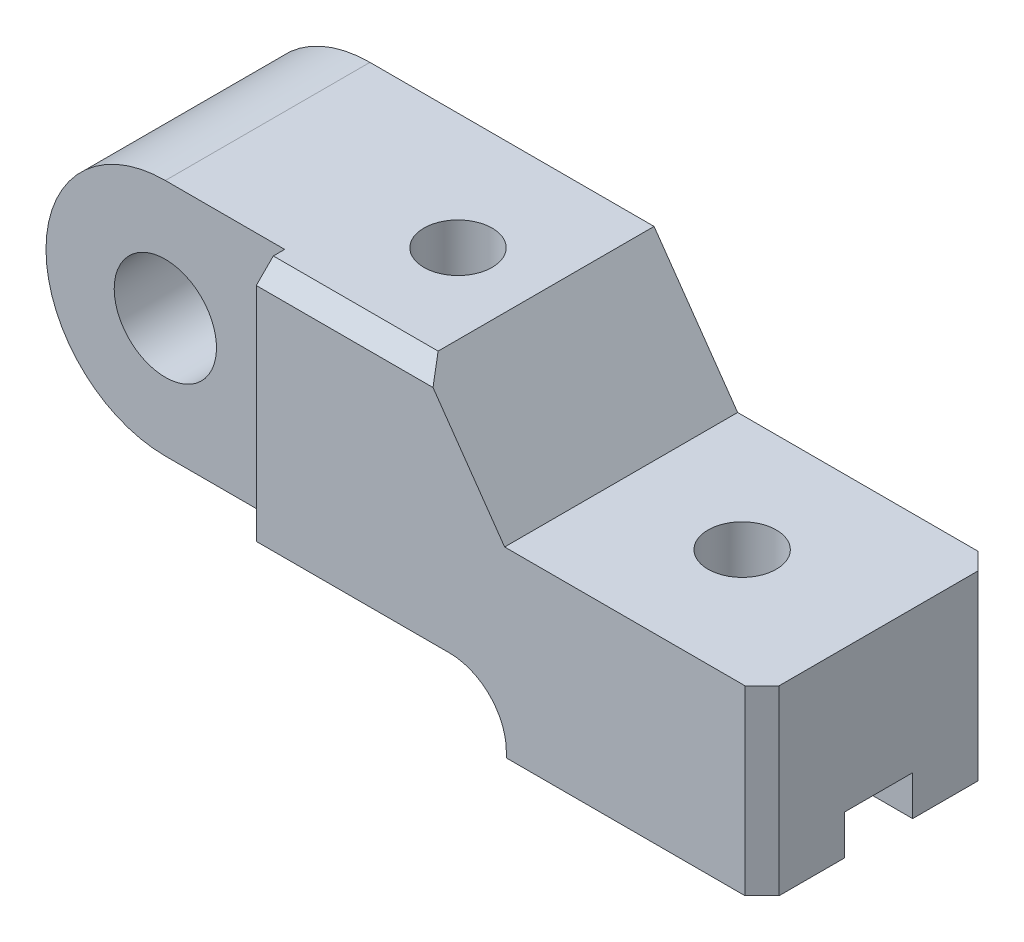
from build123d import *

# Parameters (mm, degrees)
SKETCH1_R           = 21
SKETCH1_R_2         = 9
BOSS_EXTRUDE1_DEPTH = 20.5
SKETCH2_R           = 6
SKETCH2_W           = 42
SKETCH2_H           = 5
CUT_EXTRUDE1_DEPTH  = 55
SKETCH3_W           = 12
SKETCH3_H           = 7
CUT_EXTRUDE2_DEPTH  = 55
CHAMFER1_SIZE       = 3


with BuildPart() as part:
    # Sketch1 → Boss-Extrude1 (new, symmetric)
    # profile 1 of 2: a face of its own
    with BuildSketch(Plane.XY):
        with BuildLine():
            Line((50, 21), (0, 21))
            ThreePointArc((0, 21), (14.849242405, 14.849242405), (21, 0))
            ThreePointArc((21, 0), (14.849242405, -14.849242405), (0, -21))
            Line((0, -21), (55, -21))
            ThreePointArc((55, -21), (62.071067812, -23.928932188), (65, -31))
            Line((65, -31), (65, -32))
            Line((65, -32), (110, -32))
            Line((110, -32), (110, 0))
            Line((110, 0), (64.704358302, 0))
            Line((64.704358302, 0), (50, 21))
        make_face()
    # profile 2 of 2: a face of its own
    with BuildSketch(Plane.XY):
        Circle(SKETCH1_R)
        Circle(SKETCH1_R_2, mode=Mode.SUBTRACT)
    extrude(amount=BOSS_EXTRUDE1_DEPTH, both=True)

    # Sketch2 → Cut-Extrude1 (cut)
    with BuildSketch(Plane(origin=(0, 21, 0), x_dir=(1, 0, 0), z_dir=(0, 1, 0))):
        with Locations(Location((36, 0, 0), (0, 0, 180))):
            Circle(SKETCH2_R)
        with Locations(Location((86, 0, 0), (0, 0, 270))):
            Circle(SKETCH2_R)
        with Locations((0, -18)):
            Rectangle(SKETCH2_W, SKETCH2_H)
    extrude(amount=-CUT_EXTRUDE1_DEPTH, mode=Mode.SUBTRACT)

    # Sketch3 → Cut-Extrude2 (cut)
    with BuildSketch(Plane(origin=(110, 0, 0), x_dir=(0, 0, -1), z_dir=(1, 0, 0))):
        with Locations((0, -28.5)):
            Rectangle(SKETCH3_W, SKETCH3_H)
    extrude(amount=-CUT_EXTRUDE2_DEPTH, mode=Mode.SUBTRACT)

    # Chamfer1
    chamfer1_edges = [part.edges().sort_by_distance(p)[0] for p in [
        (110, -16, -20.5),
        (110, -16, 20.5),
        (35.5, 21, 20.5),
    ]]
    chamfer(chamfer1_edges, length=CHAMFER1_SIZE)


solid = part.part
